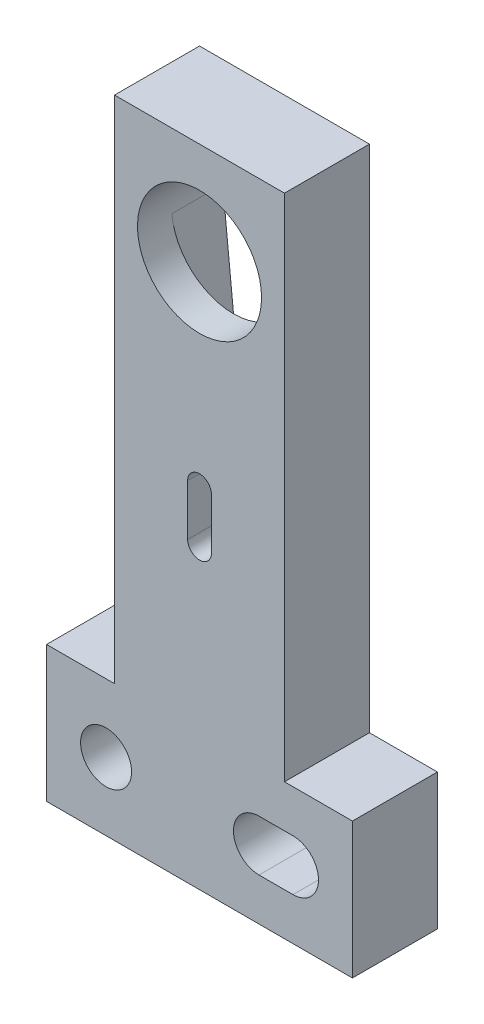
from build123d import *

# Parameters (mm, degrees)
ESBO_O1_R                = 1.5
ESBO_O1_R_2              = 3.65
RESSALTO_EXTRUS_O1_DEPTH = 5
CORTE_EXTRUS_O1_DEPTH    = 3


with BuildPart() as part:
    # Esboço1 → Ressalto-extrusão1 (new body)
    with BuildSketch(Plane.XY):
        Polygon((5, 0), (0, 0), (-5, 0), (-5, -30), (-9, -30), (-9, -38), (9, -38), (9, -30), (5, -30), align=None)
        with Locations((-5.5, -34)):
            Circle(ESBO_O1_R, mode=Mode.SUBTRACT)
        with BuildLine():
            Line((3.5, -32.5), (5.5, -32.5))
            ThreePointArc((5.5, -32.5), (7, -34), (5.5, -35.5))
            Line((5.5, -35.5), (3.5, -35.5))
            ThreePointArc((3.5, -35.5), (2, -34), (3.5, -32.5))
        make_face(mode=Mode.SUBTRACT)
        with Locations((0, -6)):
            Circle(ESBO_O1_R_2, mode=Mode.SUBTRACT)
        with BuildLine():
            ThreePointArc((-0.7, -17.5), (0, -16.8), (0.7, -17.5))
            Line((0.7, -17.5), (0.7, -20.5))
            ThreePointArc((0.7, -20.5), (0, -21.2), (-0.7, -20.5))
            Line((-0.7, -20.5), (-0.7, -17.5))
        make_face(mode=Mode.SUBTRACT)
    extrude(amount=RESSALTO_EXTRUS_O1_DEPTH)

    # Esboço1<3> → Corte-extrusão1 (cut)
    with BuildSketch(Plane.XY):
        with BuildLine():
            ThreePointArc((-2.238721733, -20.225), (0, -22.25), (2.238721733, -20.225))
            Line((2.238721733, -20.225), (3.631704145, -6.365))
            ThreePointArc((3.631704145, -6.365), (0, -9.65), (-3.631704145, -6.365))
            Line((-3.631704145, -6.365), (-2.238721733, -20.225))
        make_face()
        with BuildLine():
            ThreePointArc((0.7, -20.5), (0, -21.2), (-0.7, -20.5))
            Line((-0.7, -20.5), (-0.7, -17.5))
            ThreePointArc((-0.7, -17.5), (0, -16.8), (0.7, -17.5))
            Line((0.7, -17.5), (0.7, -20.5))
        make_face(mode=Mode.SUBTRACT)
    extrude(amount=CORTE_EXTRUS_O1_DEPTH, mode=Mode.SUBTRACT)


solid = part.part
